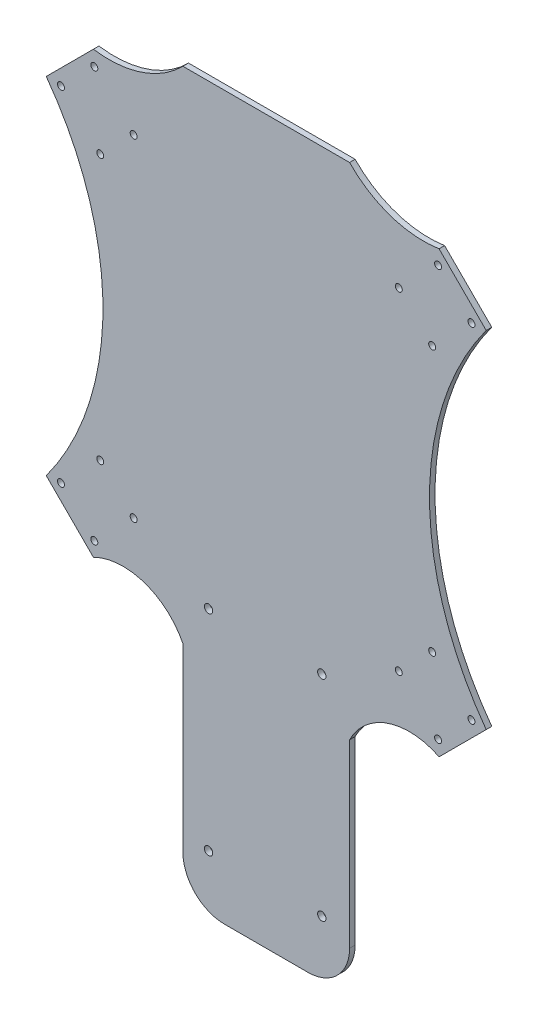
from build123d import *

# Parameters (mm, degrees)
BOSS_EXTRUDE1_DEPTH = 2
SKETCH3_R           = 1.25
CUT_EXTRUDE1_DEPTH  = 188.552659272
SKETCH4_R           = 1.5
CUT_EXTRUDE2_DEPTH  = 188.552659272


with BuildPart() as part:
    # Sketch2 → Boss-Extrude1 (new body)
    with BuildSketch(Plane.XY):
        with BuildLine():
            Line((-79.195959493, 62.225396744), (-62.225396744, 79.195959493))
            ThreePointArc((-62.225396744, 79.195959493), (-44.806778225, 80.702789346), (-30, 90))
            Line((-30, 90), (30, 90))
            ThreePointArc((30, 90), (44.806778225, 80.702789346), (62.225396744, 79.195959493))
            Line((62.225396744, 79.195959493), (79.195959493, 62.225396744))
            ThreePointArc((79.195959493, 62.225396744), (58.781303002, 0), (79.195959493, -62.225396744))
            Line((79.195959493, -62.225396744), (62.225396744, -79.195959493))
            ThreePointArc((62.225396744, -79.195959493), (43.875108319, -77.923881554), (30, -90))
            Line((30, -90), (30, -155))
            ThreePointArc((30, -155), (25.606601718, -165.606601718), (15, -170))
            Line((15, -170), (-15, -170))
            ThreePointArc((-15, -170), (-25.606601718, -165.606601718), (-30, -155))
            Line((-30, -155), (-30, -90))
            ThreePointArc((-30, -90), (-43.875108319, -77.923881554), (-62.225396744, -79.195959493))
            Line((-62.225396744, -79.195959493), (-79.195959493, -62.225396744))
            ThreePointArc((-79.195959493, -62.225396744), (-58.781303002, 0), (-79.195959493, 62.225396744))
        make_face()
    extrude(amount=BOSS_EXTRUDE1_DEPTH)

    # Sketch3 → Cut-Extrude1 (cut, through all)
    with BuildSketch(Plane.XY.offset(2)):
        with Locations((-73.892658634, 61.871843354)):
            Circle(SKETCH3_R)
        with Locations((-59.75052301, 47.72970773)):
            Circle(SKETCH3_R)
        with Locations(Location((-61.871843354, 73.892658634, 0), (0, 0, 180))):
            Circle(SKETCH3_R)
        with Locations(Location((-47.72970773, 59.75052301, 0), (0, 0, 180))):
            Circle(SKETCH3_R)
        with Locations(Location((59.75052301, 47.72970773, 0), (0, 0, 180))):
            Circle(SKETCH3_R)
        with Locations(Location((73.892658634, 61.871843354, 0), (0, 0, 180))):
            Circle(SKETCH3_R)
        with Locations((61.871843354, 73.892658634)):
            Circle(SKETCH3_R)
        with Locations((47.72970773, 59.75052301)):
            Circle(SKETCH3_R)
        with Locations(Location((-59.75052301, -47.72970773, 0), (0, 0, 180))):
            Circle(SKETCH3_R)
        with Locations((-47.72970773, -59.75052301)):
            Circle(SKETCH3_R)
        with Locations((-61.871843354, -73.892658634)):
            Circle(SKETCH3_R)
        with Locations(Location((-73.892658634, -61.871843354, 0), (0, 0, 180))):
            Circle(SKETCH3_R)
        with Locations((59.75052301, -47.72970773)):
            Circle(SKETCH3_R)
        with Locations((73.892658634, -61.871843354)):
            Circle(SKETCH3_R)
        with Locations(Location((61.871843354, -73.892658634, 0), (0, 0, 180))):
            Circle(SKETCH3_R)
        with Locations(Location((47.72970773, -59.75052301, 0), (0, 0, 180))):
            Circle(SKETCH3_R)
    extrude(amount=-CUT_EXTRUDE1_DEPTH, mode=Mode.SUBTRACT)

    # Sketch4 → Cut-Extrude2 (cut, through all)
    with BuildSketch(Plane.XY.offset(2)):
        with Locations((-20.76, -150)):
            Circle(SKETCH4_R)
        with Locations((20, -150)):
            Circle(SKETCH4_R)
        with Locations((-20.76, -74.5)):
            Circle(SKETCH4_R)
        with Locations((20, -74.5)):
            Circle(SKETCH4_R)
    extrude(amount=-CUT_EXTRUDE2_DEPTH, mode=Mode.SUBTRACT)


solid = part.part
